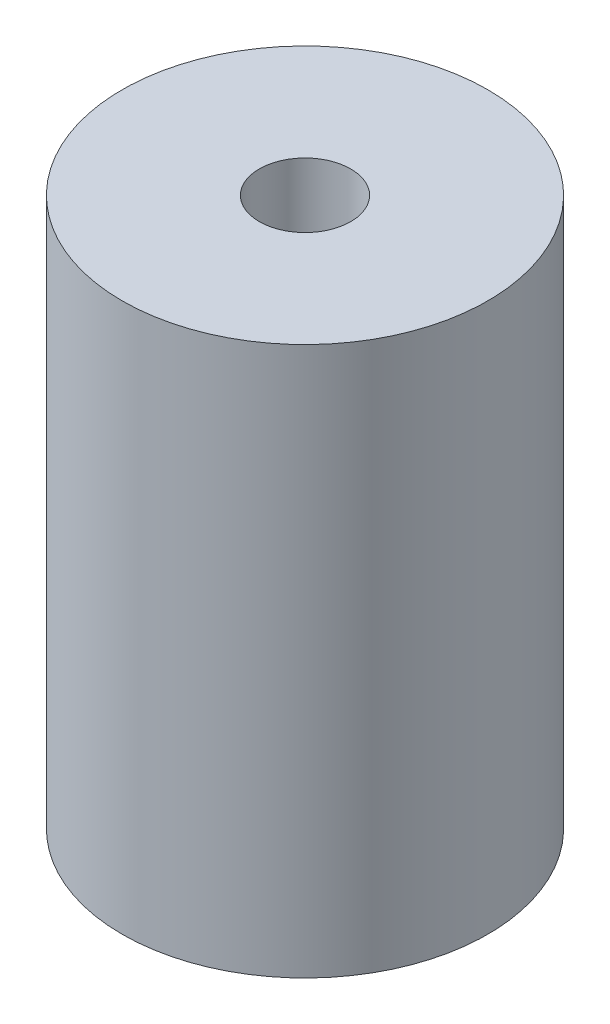
from build123d import *

# Parameters (mm, degrees)
SKETCH1_R           = 10
BOSS_EXTRUDE1_DEPTH = 30
SKETCH2_R           = 2.5
CUT_EXTRUDE1_DEPTH  = 30


with BuildPart() as part:
    # Sketch1 → Boss-Extrude1 (new body)
    with BuildSketch(Plane(origin=(0, 0, 0), x_dir=(1, 0, 0), z_dir=(0, 1, 0))):
        with Locations(Location((0, 0, 0), (0, 0, 270))):
            Circle(SKETCH1_R)
    extrude(amount=BOSS_EXTRUDE1_DEPTH)

    # Sketch2 → Cut-Extrude1 (cut)
    with BuildSketch(Plane(origin=(0, 30, 0), x_dir=(1, 0, 0), z_dir=(0, 1, 0))):
        with Locations(Location((0, 0, 0), (0, 0, 270))):
            Circle(SKETCH2_R)
    extrude(amount=-CUT_EXTRUDE1_DEPTH, mode=Mode.SUBTRACT)


solid = part.part
